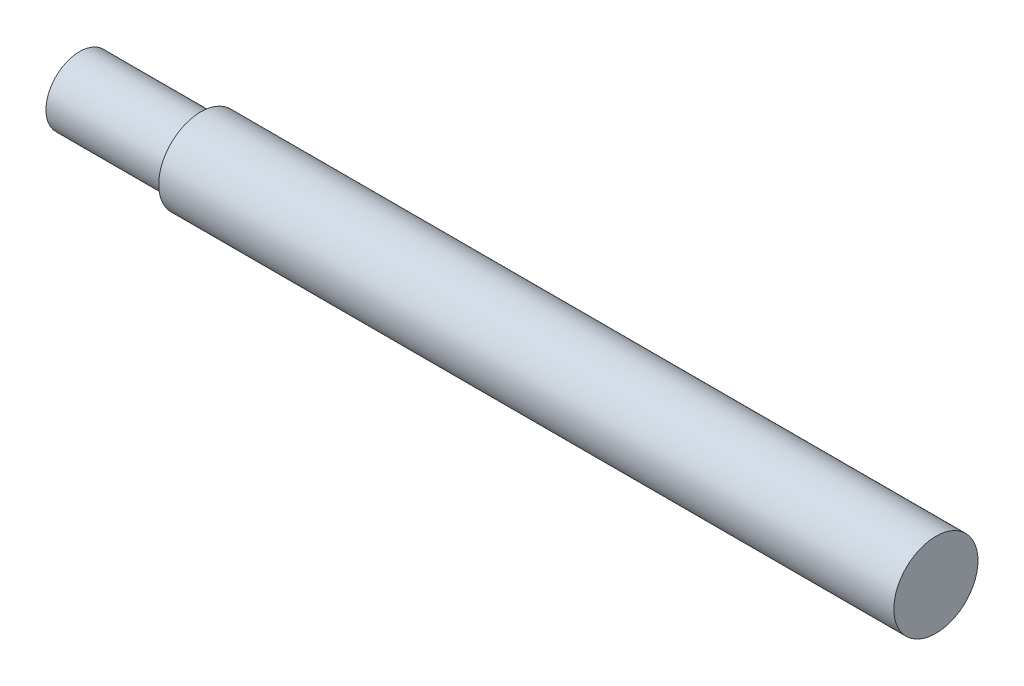
from build123d import *

# Parameters (mm, degrees)
SKETCH2_R           = 3.96875
BOSS_EXTRUDE1_DEPTH = 69.342
SKETCH3_R           = 3.175
BOSS_EXTRUDE2_DEPTH = 11.43


with BuildPart() as part:
    # Sketch2 → Boss-Extrude1 (new body)
    with BuildSketch(Plane(origin=(0, 0, 0), x_dir=(0, 0, -1), z_dir=(1, 0, 0))):
        Circle(SKETCH2_R)
    extrude(amount=BOSS_EXTRUDE1_DEPTH)

    # Sketch3 → Boss-Extrude2 (add)
    with BuildSketch(Plane(origin=(0, 0, 0), x_dir=(0, 0, -1), z_dir=(1, 0, 0))):
        Circle(SKETCH3_R)
    extrude(amount=-BOSS_EXTRUDE2_DEPTH)


solid = part.part
